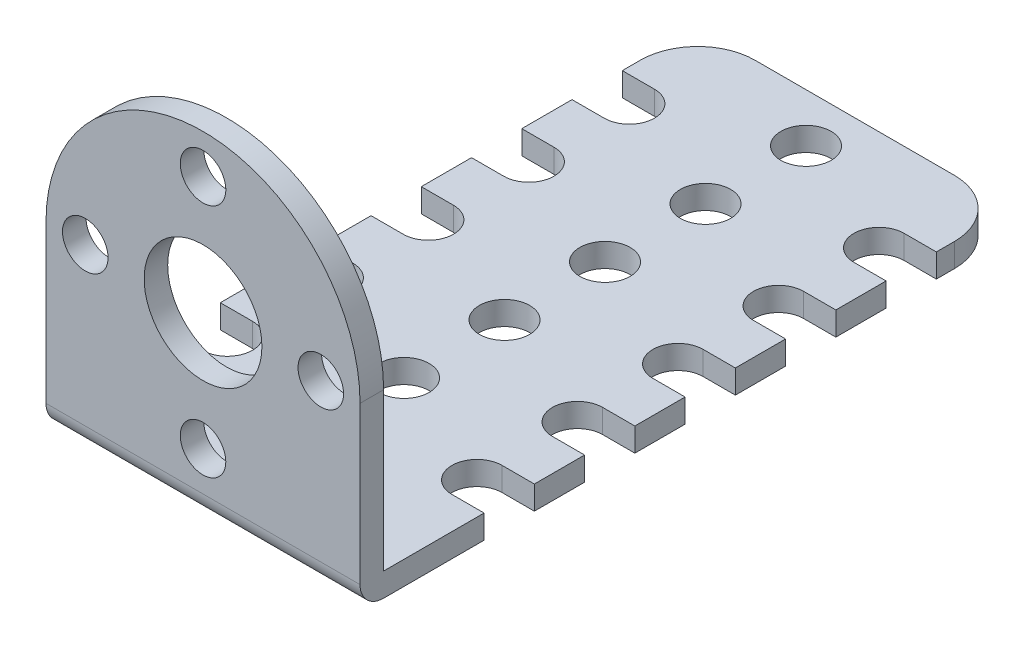
from build123d import *

# Parameters (mm, degrees)
BOSS_EXTRUDE1_DEPTH  = 20
CUT_EXTRUDE2_DEPTH   = 20
CUT_EXTRUDE3_DEPTH   = 20
SKETCH4_R            = 3.75
CUT_EXTRUDE4_DEPTH   = 20
SKETCH5_R            = 1.45
CUT_EXTRUDE5_DEPTH   = 20
CIRPATTERN1_COUNT    = 4
SKETCH6_R            = 1.6
CUT_EXTRUDE6_DEPTH   = 20
LPATTERN1_COUNT      = 6
LPATTERN1_PITCH      = 6.4
CUT_EXTRUDE7_DEPTH   = 20
LPATTERN2_COUNT      = 5
LPATTERN2_PITCH      = 6.4
MIRROR1_COPY_1_DEPTH = 20
MIRROR1_COPY_2_DEPTH = 20
MIRROR1_COPY_3_DEPTH = 20
MIRROR1_COPY_4_DEPTH = 20
FILLET3_R            = 3.65
FILLET4_R            = 3.65


with BuildPart() as part:
    # Sketch1 → Boss-Extrude1 (new body)
    with BuildSketch(Plane(origin=(0, 0, 0), x_dir=(0, 0, -1), z_dir=(1, 0, 0))):
        Polygon((0, 0), (0, 20), (-1.5, 20), (-1.5, -1.5), (40, -1.5), (40, 0), align=None)
    extrude(amount=-BOSS_EXTRUDE1_DEPTH)

    # Sketch2 → Cut-Extrude2 (cut)
    with BuildSketch(Plane(origin=(0, 0, 0), x_dir=(0, 0, -1), z_dir=(1, 0, 0))):
        with BuildLine():
            Line((-1.5, 0), (-1.5, -1.5))
            Line((-1.5, -1.5), (0, -1.5))
            ThreePointArc((0, -1.5), (-1.060660172, -1.060660172), (-1.5, 0))
        make_face()
    extrude(amount=-CUT_EXTRUDE2_DEPTH, mode=Mode.SUBTRACT)

    # Sketch3 → Cut-Extrude3 (cut)
    with BuildSketch(Plane.XY.offset(1.5)):
        with BuildLine():
            Line((-20, 10), (-20, 21.790535073))
            Line((-20, 21.790535073), (0, 21.790535073))
            Line((0, 21.790535073), (0, 10))
            ThreePointArc((0, 10), (-10, 20), (-20, 10))
        make_face()
    extrude(amount=-CUT_EXTRUDE3_DEPTH, mode=Mode.SUBTRACT)

    # Sketch4 → Cut-Extrude4 (cut)
    with BuildSketch(Plane.XY.offset(1.5)):
        with Locations((-10, 10)):
            Circle(SKETCH4_R)
    extrude(amount=-CUT_EXTRUDE4_DEPTH, mode=Mode.SUBTRACT)

    # Sketch5 → Cut-Extrude5 (cut)
    with BuildSketch(Plane.XY.offset(1.5)):
        with Locations((-10, 2.5)):
            Circle(SKETCH5_R)
    cut_extrude5 = extrude(amount=-CUT_EXTRUDE5_DEPTH, mode=Mode.SUBTRACT)

    # CirPattern1: Cut-Extrude5 ×4 about axis
    cirpattern1_axis = Axis((-10, 10, 0), (0, 0, 1))
    for i in range(1, CIRPATTERN1_COUNT):
        add(cut_extrude5.rotate(cirpattern1_axis, i * 360 / CIRPATTERN1_COUNT), mode=Mode.SUBTRACT)

    # Sketch6 → Cut-Extrude6 (cut)
    with BuildSketch(Plane(origin=(0, 0, 0), x_dir=(1, 0, 0), z_dir=(0, 1, 0))):
        with Locations(Location((-10, 4.9, 0), (0, 0, 270))):
            Circle(SKETCH6_R)
    cut_extrude6 = extrude(amount=-CUT_EXTRUDE6_DEPTH, mode=Mode.SUBTRACT)

    # LPattern1: Cut-Extrude6 ×6
    with Locations(*[(0, 0, -i * LPATTERN1_PITCH) for i in range(1, LPATTERN1_COUNT)]):
        add(cut_extrude6, mode=Mode.SUBTRACT)

    # Sketch7 → Cut-Extrude7 (cut)
    with BuildSketch(Plane(origin=(0, 0, 0), x_dir=(1, 0, 0), z_dir=(0, 1, 0))):
        with BuildLine():
            Line((0, 6.4), (-2.05, 6.4))
            ThreePointArc((-2.05, 6.4), (-3.65, 8), (-2.05, 9.6))
            Line((-2.05, 9.6), (0, 9.6))
            Line((0, 9.6), (0, 6.4))
        make_face()
    cut_extrude7 = extrude(amount=-CUT_EXTRUDE7_DEPTH, mode=Mode.SUBTRACT)

    # LPattern2: Cut-Extrude7 ×5
    with Locations(*[(0, 0, -i * LPATTERN2_PITCH) for i in range(1, LPATTERN2_COUNT)]):
        add(cut_extrude7, mode=Mode.SUBTRACT)

    # Mirror1: Cut-Extrude7 across plane
    add(cut_extrude7.mirror(Plane.ZY.offset(10)), mode=Mode.SUBTRACT)

    # Mirror1 copy 1 sketch → Mirror1 copy 1 (cut)
    with BuildSketch(Plane(origin=(-20, 0, -6.4), x_dir=(-1, 0, 0), z_dir=(0, 1, 0))):
        with BuildLine():
            Line((0, -6.4), (-2.05, -6.4))
            ThreePointArc((-2.05, -6.4), (-3.65, -8), (-2.05, -9.6))
            Line((-2.05, -9.6), (0, -9.6))
            Line((0, -9.6), (0, -6.4))
        make_face()
    extrude(amount=-MIRROR1_COPY_1_DEPTH, mode=Mode.SUBTRACT)

    # Mirror1 copy 2 sketch → Mirror1 copy 2 (cut)
    with BuildSketch(Plane(origin=(-20, 0, -12.8), x_dir=(-1, 0, 0), z_dir=(0, 1, 0))):
        with BuildLine():
            Line((0, -6.4), (-2.05, -6.4))
            ThreePointArc((-2.05, -6.4), (-3.65, -8), (-2.05, -9.6))
            Line((-2.05, -9.6), (0, -9.6))
            Line((0, -9.6), (0, -6.4))
        make_face()
    extrude(amount=-MIRROR1_COPY_2_DEPTH, mode=Mode.SUBTRACT)

    # Mirror1 copy 3 sketch → Mirror1 copy 3 (cut)
    with BuildSketch(Plane(origin=(-20, 0, -19.2), x_dir=(-1, 0, 0), z_dir=(0, 1, 0))):
        with BuildLine():
            Line((0, -6.4), (-2.05, -6.4))
            ThreePointArc((-2.05, -6.4), (-3.65, -8), (-2.05, -9.6))
            Line((-2.05, -9.6), (0, -9.6))
            Line((0, -9.6), (0, -6.4))
        make_face()
    extrude(amount=-MIRROR1_COPY_3_DEPTH, mode=Mode.SUBTRACT)

    # Mirror1 copy 4 sketch → Mirror1 copy 4 (cut)
    with BuildSketch(Plane(origin=(-20, 0, -25.6), x_dir=(-1, 0, 0), z_dir=(0, 1, 0))):
        with BuildLine():
            Line((0, -6.4), (-2.05, -6.4))
            ThreePointArc((-2.05, -6.4), (-3.65, -8), (-2.05, -9.6))
            Line((-2.05, -9.6), (0, -9.6))
            Line((0, -9.6), (0, -6.4))
        make_face()
    extrude(amount=-MIRROR1_COPY_4_DEPTH, mode=Mode.SUBTRACT)

    # Fillet3
    fillet3_edges = [part.edges().sort_by_distance(p)[0] for p in [
        (0, -0.75, -40),
    ]]
    fillet(fillet3_edges, radius=FILLET3_R)

    # Fillet4
    fillet4_edges = [part.edges().sort_by_distance(p)[0] for p in [
        (-20, -0.75, -40),
    ]]
    fillet(fillet4_edges, radius=FILLET4_R)


solid = part.part
